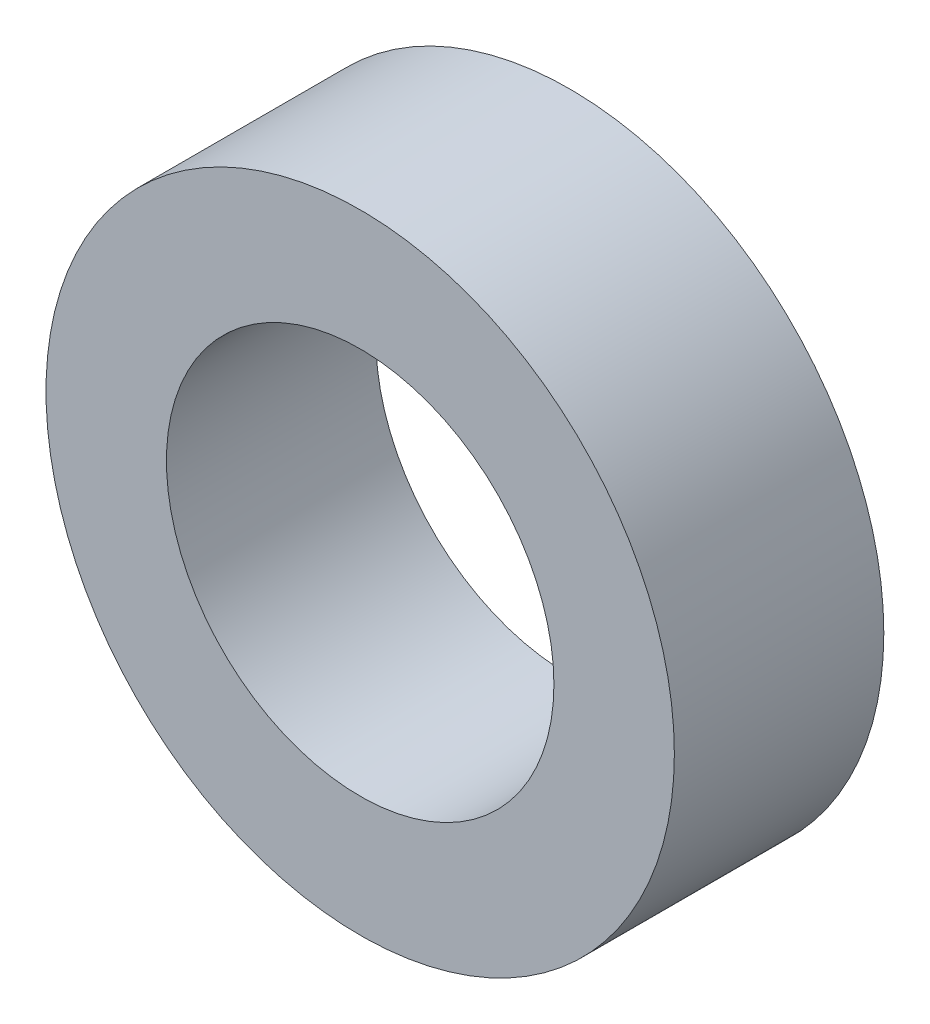
from build123d import *

# Parameters (mm, degrees)
SKETCH1_R           = 3
SKETCH1_R_2         = 1.85
BOSS_EXTRUDE1_DEPTH = 2


with BuildPart() as part:
    # Sketch1 → Boss-Extrude1 (new body)
    with BuildSketch(Plane.XY):
        Circle(SKETCH1_R)
        Circle(SKETCH1_R_2, mode=Mode.SUBTRACT)
    extrude(amount=BOSS_EXTRUDE1_DEPTH)


solid = part.part
